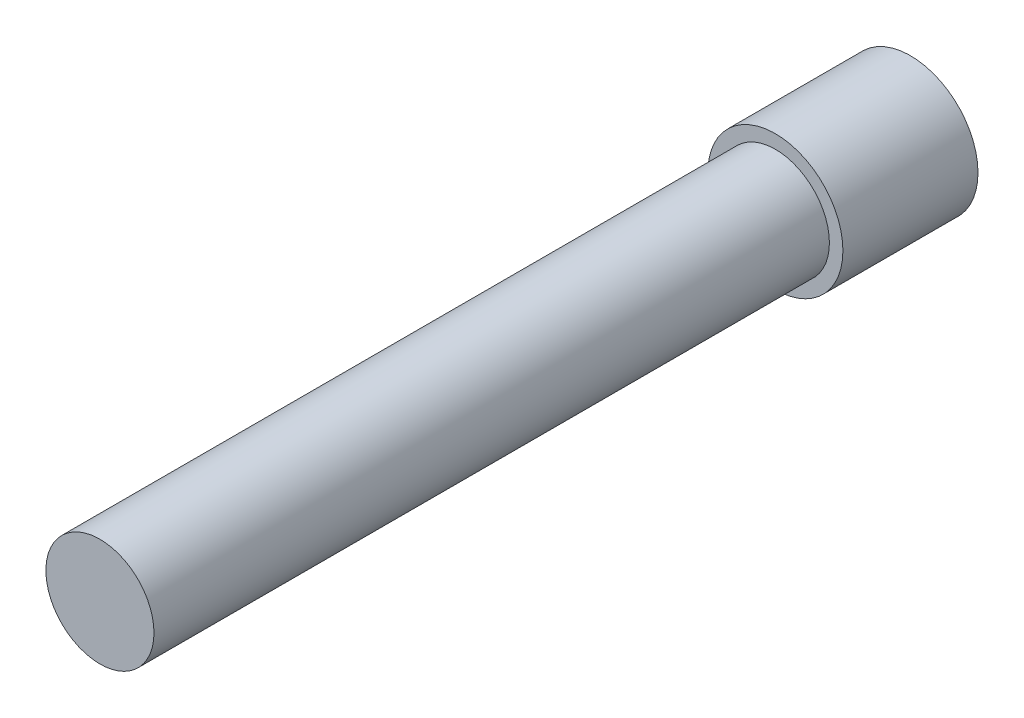
from build123d import *


with BuildPart() as part:
    # Sketch1 → Revolve1 (revolve)
    with BuildSketch(Plane(origin=(0, 0, 0), x_dir=(1, 0, 0), z_dir=(0, 1, 0))):
        Polygon((0, 0), (4, 0), (4, 50), (5, 50), (5, 60), (0, 60), align=None)
    revolve(axis=Axis((0, 0, 0), (0, 0, -1)))


solid = part.part
